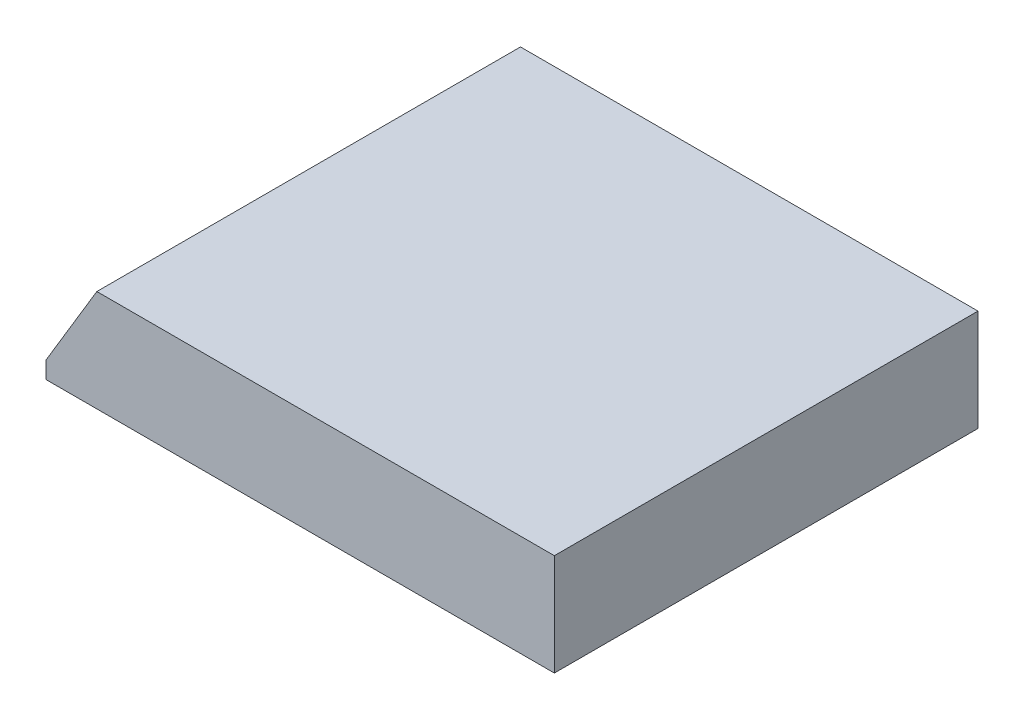
from build123d import *

# Parameters (mm, degrees)
SKETCH1_W           = 60
SKETCH1_H           = 12
BOSS_EXTRUDE1_DEPTH = 50
CUT_EXTRUDE1_DEPTH  = 80.018985061


with BuildPart() as part:
    # Sketch1 → Boss-Extrude1 (new body)
    with BuildSketch(Plane.XY):
        with Locations((30, 6)):
            Rectangle(SKETCH1_W, SKETCH1_H)
    extrude(amount=BOSS_EXTRUDE1_DEPTH)

    # Sketch2 → Cut-Extrude1 (cut, through all)
    with BuildSketch(Plane.XY.offset(50)):
        Polygon((0, 2), (6, 12), (0, 12), align=None)
    extrude(amount=-CUT_EXTRUDE1_DEPTH, mode=Mode.SUBTRACT)


solid = part.part
